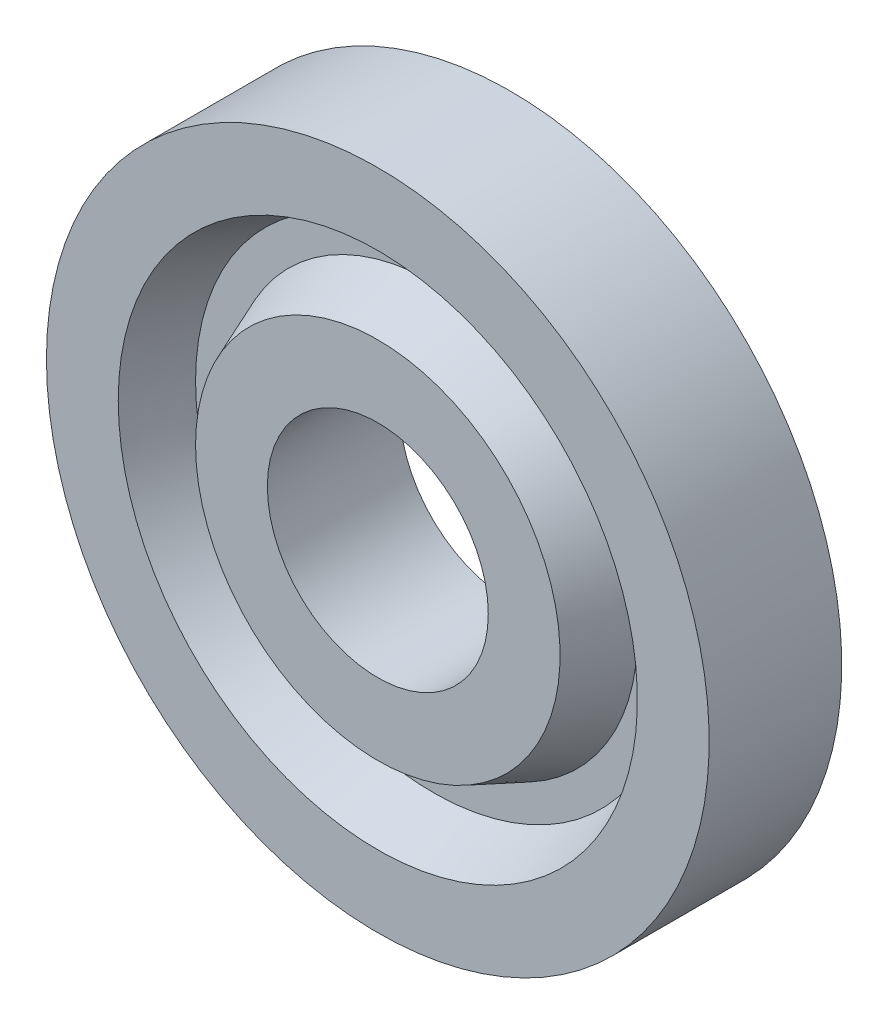
from build123d import *


with BuildPart() as part:
    # Sketch1 → Revolve1 (revolve)
    with BuildSketch(Plane(origin=(0, 0, 0), x_dir=(1, 0, 0), z_dir=(0, 1, 0)), mode=Mode.PRIVATE) as revolve1_sk:
        Polygon((8.25, 3), (9.25, 0.5), (10.75, 0.5), (11.75, 3), (15, 3), (15, -3), (11.75, -3), (10.75, -0.5), (9.25, -0.5), (8.25, -3), (5, -3), (5, 3), align=None)
    revolve(revolve1_sk.sketch.rotate(Axis((0, 0, -28.911106653), (0, 0, 1)), 180), axis=Axis((0, 0, -28.911106653), (0, 0, 1)))


solid = part.part
